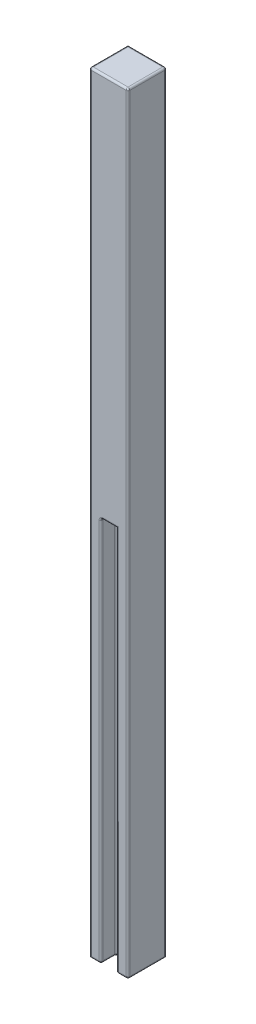
from build123d import *

# Parameters (mm, degrees)
SKETCH1_W           = 10
SKETCH1_H           = 10
BOSS_EXTRUDE1_DEPTH = 200
SKETCH2_W           = 4
SKETCH2_H           = 100
CUT_EXTRUDE1_DEPTH  = 4
FILLET1_R           = 0.5


with BuildPart() as part:
    # Sketch1 → Boss-Extrude1 (new body)
    with BuildSketch(Plane(origin=(0, 0, 0), x_dir=(1, 0, 0), z_dir=(0, 1, 0))):
        with Locations((-38.49189023, 27.694440025)):
            Rectangle(SKETCH1_W, SKETCH1_H)
    extrude(amount=BOSS_EXTRUDE1_DEPTH)

    # Sketch2 → Cut-Extrude1 (cut)
    with BuildSketch(Plane.XY.offset(-22.694440025)):
        with Locations((-38.49189023, 50)):
            Rectangle(SKETCH2_W, SKETCH2_H)
    extrude(amount=-CUT_EXTRUDE1_DEPTH, mode=Mode.SUBTRACT)

    # Fillet1
    fillet1_edges = [part.edges().sort_by_distance(p)[0] for p in [
        (-33.49189023, 200, -27.694440025),
        (-38.49189023, 200, -32.694440025),
        (-34.99189023, 0, -22.694440025),
        (-40.49189023, 50, -26.694440025),
        (-40.49189023, 0, -24.694440025),
        (-38.49189023, 100, -22.694440025),
        (-40.49189023, 100, -24.694440025),
        (-36.49189023, 50, -22.694440025),
        (-38.49189023, 0, -26.694440025),
        (-36.49189023, 0, -24.694440025),
        (-38.49189023, 100, -26.694440025),
        (-36.49189023, 50, -26.694440025),
        (-40.49189023, 50, -22.694440025),
        (-43.49189023, 200, -27.694440025),
        (-33.49189023, 0, -27.694440025),
        (-41.99189023, 0, -22.694440025),
        (-38.49189023, 200, -22.694440025),
        (-33.49189023, 100, -32.694440025),
        (-33.49189023, 100, -22.694440025),
        (-43.49189023, 100, -22.694440025),
    ]]
    fillet(fillet1_edges, radius=FILLET1_R)


solid = part.part
